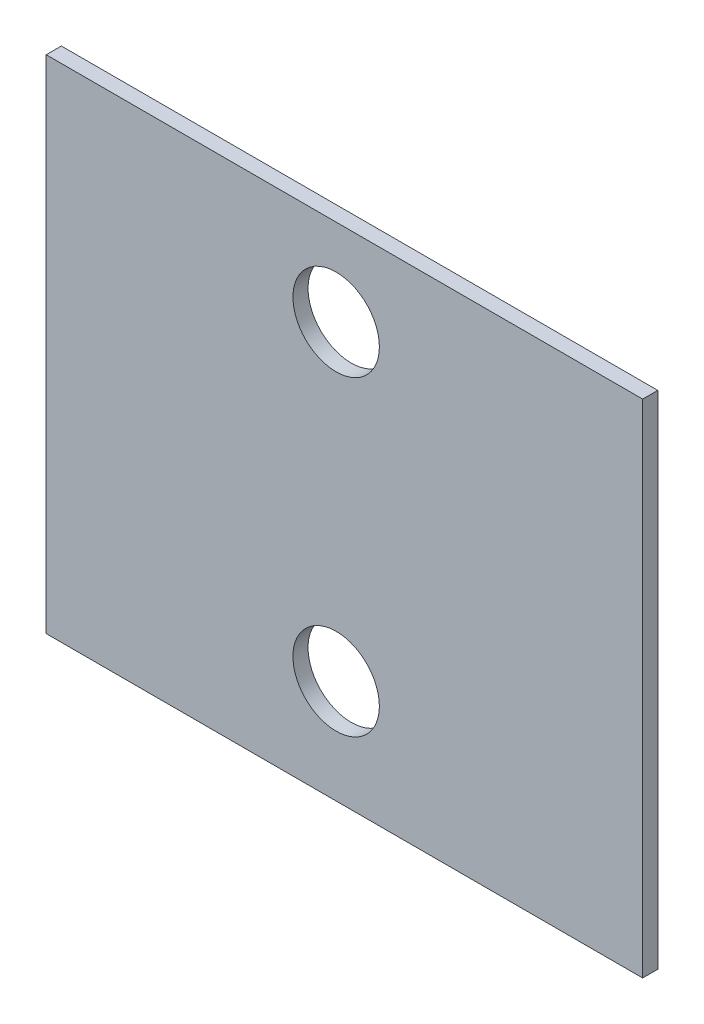
from build123d import *

# Parameters (mm, degrees)
SKETCH1_W           = 69
SKETCH1_H           = 58
SKETCH1_R           = 5
BOSS_EXTRUDE1_DEPTH = 1.75


with BuildPart() as part:
    # Sketch1 → Boss-Extrude1 (new body)
    with BuildSketch(Plane.XY):
        with Locations((-2, -1.5)):
            Rectangle(SKETCH1_W, SKETCH1_H)
        with Locations((-2.958373584, 17.5)):
            Circle(SKETCH1_R, mode=Mode.SUBTRACT)
        with Locations((-2.958373584, -18.5)):
            Circle(SKETCH1_R, mode=Mode.SUBTRACT)
    extrude(amount=BOSS_EXTRUDE1_DEPTH)


solid = part.part
